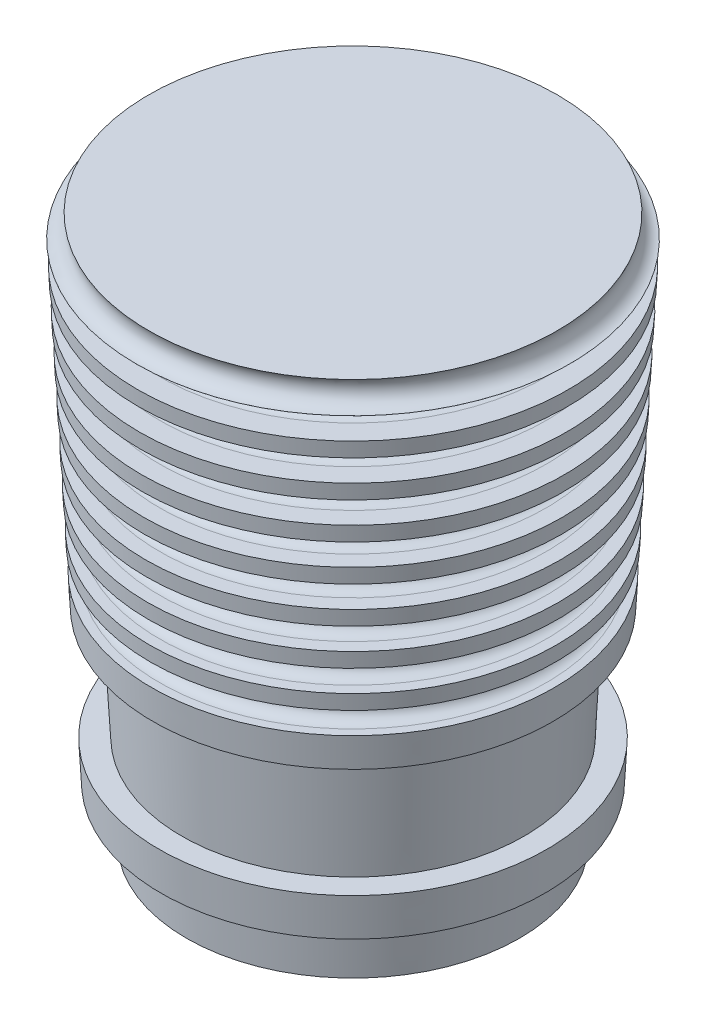
from build123d import *

# Parameters (mm, degrees)
SKETCH1_R           = 25
BOSS_EXTRUDE1_DEPTH = 72
BOSS_EXTRUDE1_DRAFT = -3
LPATTERN1_COUNT     = 8
LPATTERN1_PITCH     = 5
SKETCH5_R           = 2


with BuildPart() as part:
    # Sketch1 → Boss-Extrude1 (with draft: the straight prism first)
    with BuildSketch(Plane(origin=(0, 0, 0), x_dir=(1, 0, 0), z_dir=(0, 1, 0))):
        Circle(SKETCH1_R)
    extrude(amount=BOSS_EXTRUDE1_DEPTH)
    # Boss-Extrude1: the draft: its side faces are tilted about the plane it starts from
    boss_extrude1_sides = [part.faces().sort_by_distance(p)[0] for p in [
        (-25, 36, 0),
    ]]
    draft(boss_extrude1_sides, Plane(origin=(0, 0, 0), x_dir=(1, 0, 0), z_dir=(0, 1, 0)), BOSS_EXTRUDE1_DRAFT)

    # Sketch3 → Cut-Revolve1 (revolve, cut)
    with BuildSketch(Plane.XY, mode=Mode.PRIVATE) as cut_revolve1_sk:
        Polygon((22.366351694, 6.990406743), (22, 0), (25, 0), (25.358134537, 6.833614048), align=None)
        Polygon((23.415010041, 27), (22.628893351, 12), (25.628893351, 12), (26.415010041, 27), align=None)
    revolve(cut_revolve1_sk.sketch.rotate(Axis((0, 0, 0), (0, 1, 0)), 90), axis=Axis((0, 0, 0), (0, 1, 0)), mode=Mode.SUBTRACT)

    # Sketch4 → Cut-Revolve2 (revolve, cut)
    with BuildSketch(Plane(origin=(0, 0, 0), x_dir=(0, 0, -1), z_dir=(1, 0, 0))):
        with BuildLine():
            Line((25.533408064, 69), (28.616136771, 69))
            Line((28.616136771, 69), (28.458913433, 66))
            Line((28.458913433, 66), (25.533408064, 66))
            ThreePointArc((25.533408064, 66), (24.033408064, 67.5), (25.533408064, 69))
        make_face()
    cut_revolve2 = revolve(axis=Axis((0, 0, 0), (0, 1, 0)), mode=Mode.SUBTRACT)

    # LPattern1: Cut-Revolve2 ×8
    with Locations(*[(0, -i * LPATTERN1_PITCH, 0) for i in range(1, LPATTERN1_COUNT)]):
        add(cut_revolve2, mode=Mode.SUBTRACT)

    # Sketch5 → Cut-Revolve3 (revolve, cut)
    with BuildSketch(Plane.XY, mode=Mode.PRIVATE) as cut_revolve3_sk:
        with Locations((28.720952329, 71)):
            Circle(SKETCH5_R)
    revolve(cut_revolve3_sk.sketch.rotate(Axis((0, 0, 0), (0, 1, 0)), 270), axis=Axis((0, 0, 0), (0, 1, 0)), mode=Mode.SUBTRACT)


solid = part.part
